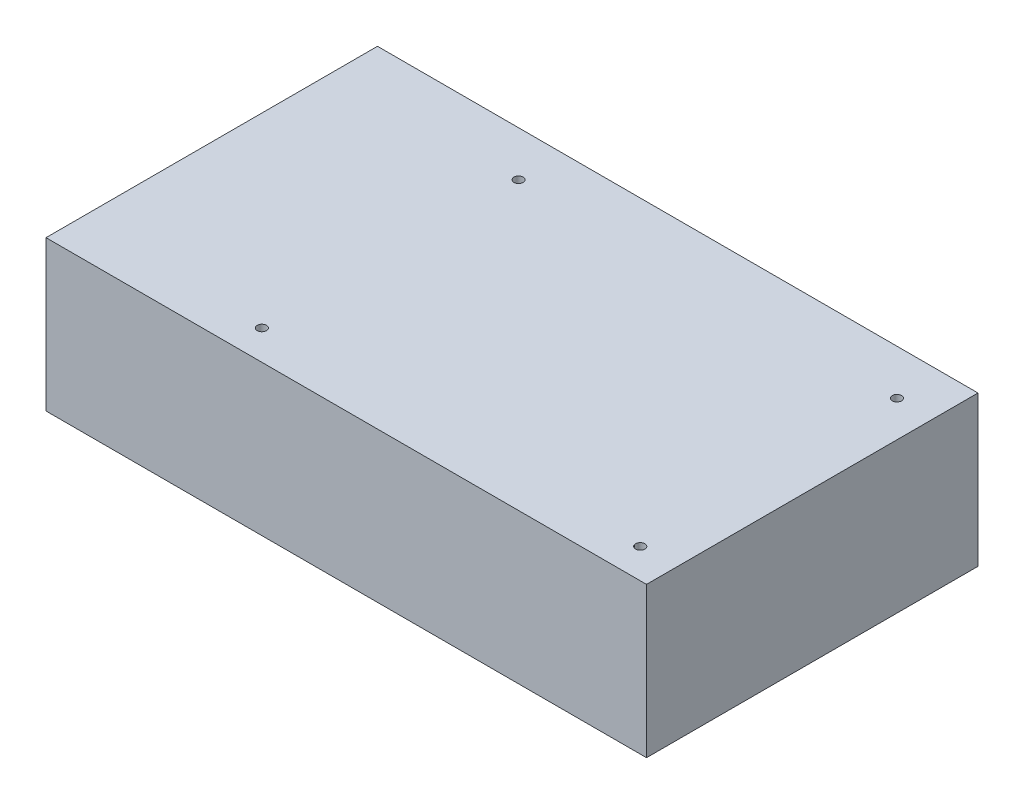
from build123d import *

# Parameters (mm, degrees)
SKETCH1_W           = 200
SKETCH1_H           = 110.4
BOSS_EXTRUDE1_DEPTH = 50
SKETCH2_R           = 1.55
CUT_EXTRUDE1_DEPTH  = 10


with BuildPart() as part:
    # Sketch1 → Boss-Extrude1 (new body)
    with BuildSketch(Plane(origin=(0, 0, 0), x_dir=(1, 0, 0), z_dir=(0, 1, 0))):
        with Locations((100, 55.2)):
            Rectangle(SKETCH1_W, SKETCH1_H)
    extrude(amount=BOSS_EXTRUDE1_DEPTH)

    # Sketch2 → Cut-Extrude1 (cut)
    with BuildSketch(Plane(origin=(0, 50, 0), x_dir=(1, 0, 0), z_dir=(0, 1, 0))):
        with Locations(Location((62, 95.4, 0), (0, 0, 270))):
            Circle(SKETCH2_R)
        with Locations(Location((188, 95.4, 0), (0, 0, 270))):
            Circle(SKETCH2_R)
        with Locations(Location((188, 9.9, 0), (0, 0, 270))):
            Circle(SKETCH2_R)
        with Locations(Location((62, 9.9, 0), (0, 0, 270))):
            Circle(SKETCH2_R)
    extrude(amount=-CUT_EXTRUDE1_DEPTH, mode=Mode.SUBTRACT)


solid = part.part
